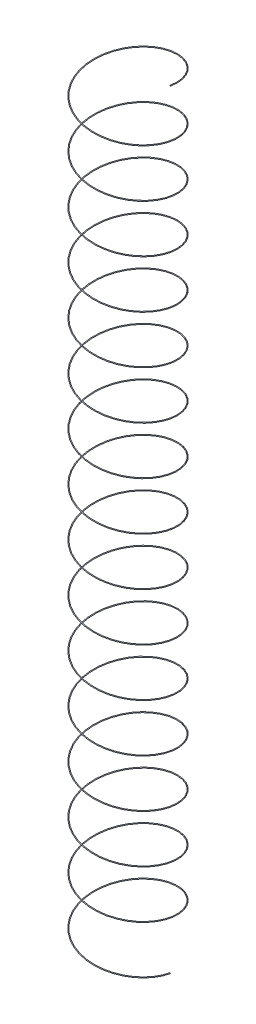
from build123d import *

# Parameters (mm, degrees)
SWEEP1_PITCH       = 31.3
SWEEP1_HEIGHT      = 500.8
SWEEP1_RADIUS      = 27.5
SWEEP1_START_ANGLE = 90
SKETCH2_R          = 0.25


with BuildPart() as part:
    # Sweep1: sweep along a helix
    with BuildLine() as sweep1_path:
        add(Helix(SWEEP1_PITCH, SWEEP1_HEIGHT, SWEEP1_RADIUS, center=(0, 0, 0), direction=(0, 1, 0), lefthand=True, mode=Mode.PRIVATE).rotate(Axis((0, 0, 0), (0, 1, 0)), SWEEP1_START_ANGLE))
    # Sketch2 → Sweep1 (sweep)
    with BuildSketch(Plane.XY):
        with Locations((27.5, 0)):
            Circle(SKETCH2_R)
    sweep(path=sweep1_path.line, is_frenet=True)


solid = part.part
